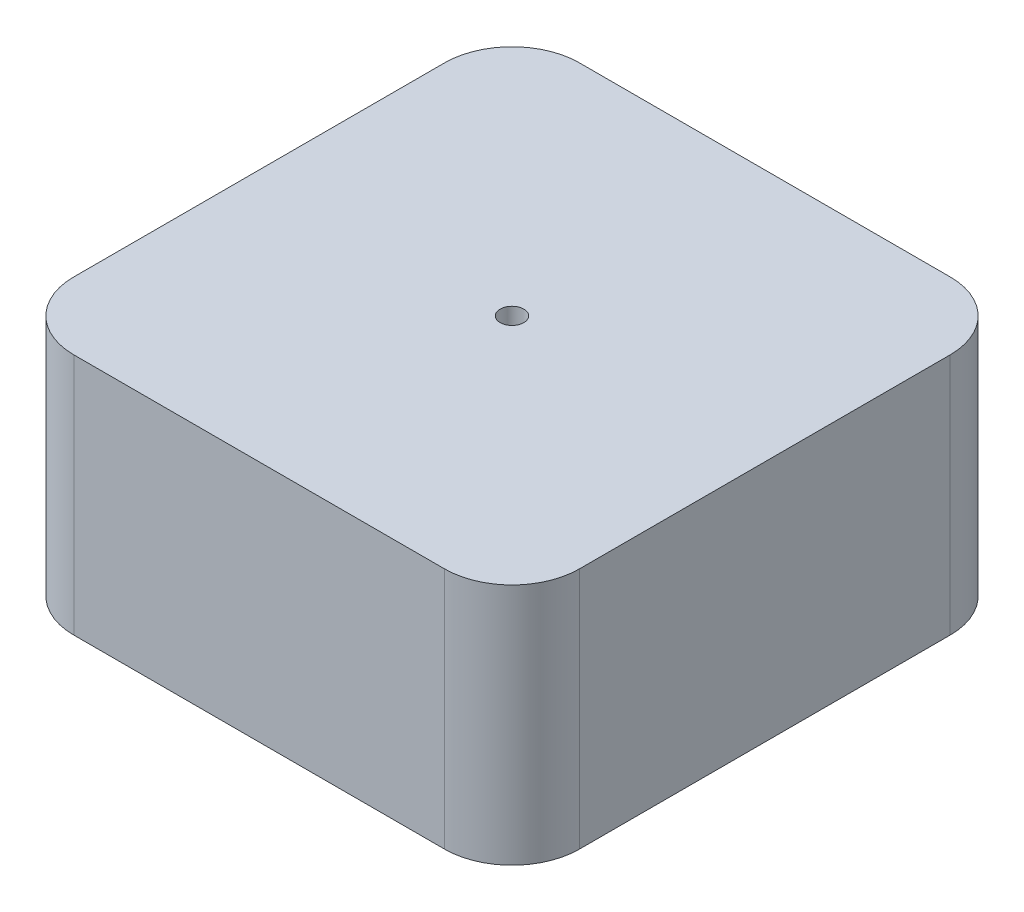
from build123d import *

# Parameters (mm, degrees)
BASE_WALLS_DEPTH     = 72
BOX_SHELL_T          = -5
SHAFT_HOLE_PROFILE_R = 3.5
CUT_EXTRUDE1_DEPTH   = 129.195163715


with BuildPart() as part:
    # Base Top Face Profile → Base Walls (new body)
    with BuildSketch(Plane(origin=(0, 0, 0), x_dir=(1, 0, 0), z_dir=(0, 1, 0))):
        with BuildLine():
            Line((-55, -75), (55, -75))
            ThreePointArc((55, -75), (69.142135624, -69.142135624), (75, -55))
            Line((75, -55), (75, 55))
            ThreePointArc((75, 55), (69.142135624, 69.142135624), (55, 75))
            Line((55, 75), (-55, 75))
            ThreePointArc((-55, 75), (-69.142135624, 69.142135624), (-75, 55))
            Line((-75, 55), (-75, -55))
            ThreePointArc((-75, -55), (-69.142135624, -69.142135624), (-55, -75))
        make_face()
    extrude(amount=-BASE_WALLS_DEPTH)

    # Box Shell
    box_shell_openings = [part.faces().sort_by_distance(p)[0] for p in [
        (0, -72, 0),
    ]]
    offset(amount=BOX_SHELL_T, openings=box_shell_openings, kind=Kind.INTERSECTION)

    # Shaft Hole Profile → Cut-Extrude1 (cut, through all)
    with BuildSketch(Plane(origin=(0, 0, 0), x_dir=(1, 0, 0), z_dir=(0, 1, 0))):
        with Locations(Location((0, 0, 0), (0, 0, 270))):
            Circle(SHAFT_HOLE_PROFILE_R)
    extrude(amount=-CUT_EXTRUDE1_DEPTH, mode=Mode.SUBTRACT)


solid = part.part
